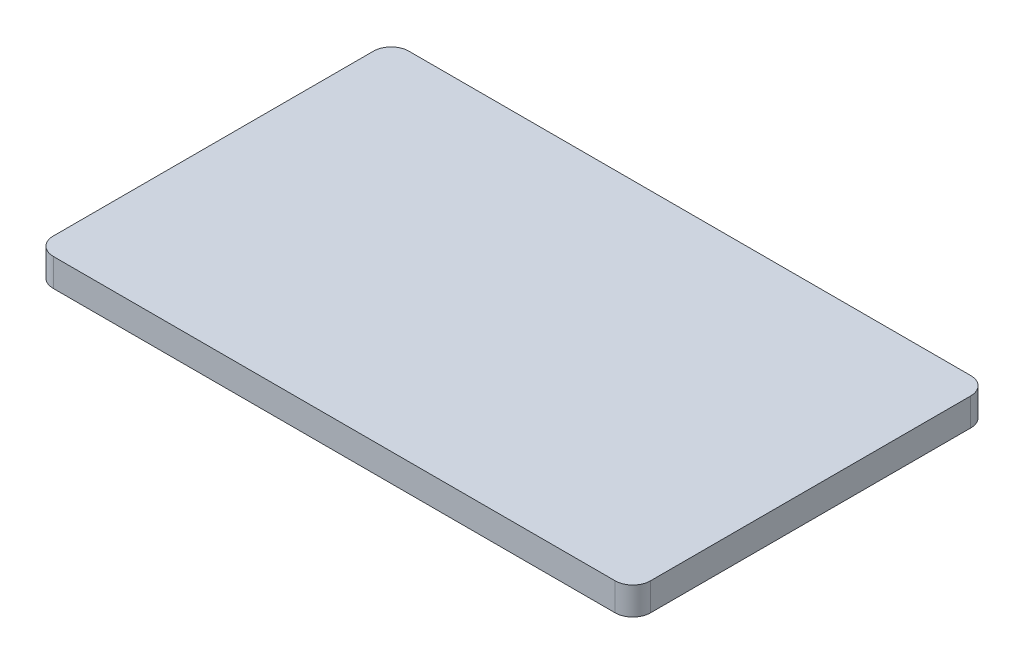
from build123d import *

# Parameters (mm, degrees)
SKETCH1_W           = 215
SKETCH1_H           = 128
BOSS_EXTRUDE1_DEPTH = 10
FILLET1_R           = 6.35


with BuildPart() as part:
    # Sketch1 → Boss-Extrude1 (new body)
    with BuildSketch(Plane(origin=(0, 0, 0), x_dir=(1, 0, 0), z_dir=(0, 1, 0))):
        Rectangle(SKETCH1_W, SKETCH1_H)
    extrude(amount=BOSS_EXTRUDE1_DEPTH)

    # Fillet1
    fillet1_edges = [part.edges().sort_by_distance(p)[0] for p in [
        (107.5, 5, 64),
        (-107.5, 5, 64),
        (-107.5, 5, -64),
        (107.5, 5, -64),
    ]]
    fillet(fillet1_edges, radius=FILLET1_R)


solid = part.part
